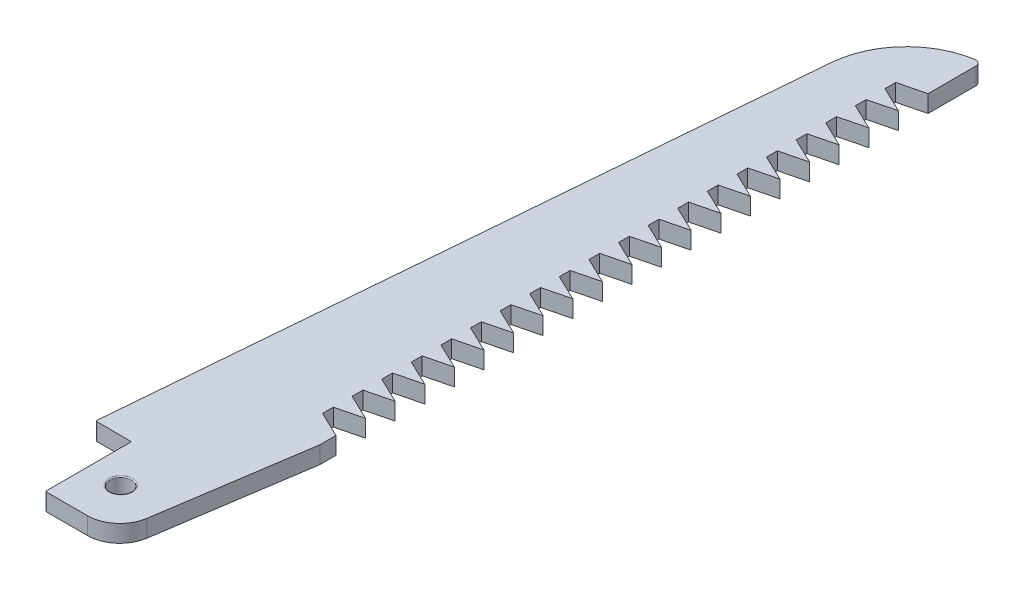
from build123d import *

# Parameters (mm, degrees)
SKETCH1_R           = 1
BOSS_EXTRUDE2_DEPTH = 1.6
SKETCH3_W           = 3.5
SKETCH3_H           = 8
CUT_EXTRUDE2_DEPTH  = 80.011454866
FILLET2_R           = 3
FILLET3_R           = 0.1
FILLET4_R           = 0.1
CUT_EXTRUDE3_DEPTH  = 80.011454866
LPATTERN7_COUNT     = 20
LPATTERN7_PITCH     = 2.75
FILLET5_R           = 0.5


with BuildPart() as part:
    # Sketch1 → Boss-Extrude2 (new body)
    with BuildSketch(Plane(origin=(0, 0, 0), x_dir=(1, 0, 0), z_dir=(0, 1, 0))):
        with BuildLine():
            Line((0, 0), (0, 6))
            Line((0, 6), (5.5, 71))
            ThreePointArc((5.5, 71), (7.72044875, 75.77955125), (12.5, 78))
            Line((12.5, 78), (12.5, 16.5))
            Line((12.5, 16.5), (10, 0))
            Line((10, 0), (0, 0))
        make_face()
        with Locations(Location((6.5, 4, 0), (0, 0, 270))):
            Circle(SKETCH1_R, mode=Mode.SUBTRACT)
    extrude(amount=BOSS_EXTRUDE2_DEPTH)

    # Sketch3 → Cut-Extrude2 (cut, through all)
    with BuildSketch(Plane(origin=(0, 1.6, 0), x_dir=(1, 0, 0), z_dir=(0, 1, 0))):
        with Locations((1.75, 4)):
            Rectangle(SKETCH3_W, SKETCH3_H)
    extrude(amount=-CUT_EXTRUDE2_DEPTH, mode=Mode.SUBTRACT)

    # Fillet2
    fillet2_edges = [part.edges().sort_by_distance(p)[0] for p in [
        (10, 0.8, 0),
    ]]
    fillet(fillet2_edges, radius=FILLET2_R)

    # Fillet3
    fillet3_edges = [part.edges().sort_by_distance(p)[0] for p in [
        (6.5, 0, -5),
        (6.5, 1.6, -5),
    ]]
    fillet(fillet3_edges, radius=FILLET3_R)

    # Fillet4
    fillet4_edges = [part.edges().sort_by_distance(p)[0] for p in [
        (0.169230769, 0.8, -8),
        (3.5, 0.8, -8),
        (3.5, 0.8, 0),
    ]]
    fillet(fillet4_edges, radius=FILLET4_R)

    # Sketch4 → Cut-Extrude3 (cut, through all)
    with BuildSketch(Plane(origin=(0, 1.6, 0), x_dir=(1, 0, 0), z_dir=(0, 1, 0))):
        Polygon((12.5, 73), (10.1, 72.398256348), (10.1, 71.398256348), (12.5, 70.25), align=None)
    cut_extrude3 = extrude(amount=-CUT_EXTRUDE3_DEPTH, mode=Mode.SUBTRACT)

    # LPattern7: Cut-Extrude3 ×20
    with Locations(*[(0, 0, i * LPATTERN7_PITCH) for i in range(1, LPATTERN7_COUNT)]):
        add(cut_extrude3, mode=Mode.SUBTRACT)

    # Fillet5
    fillet5_edges = [part.edges().sort_by_distance(p)[0] for p in [
        (12.5, 0.8, -78),
    ]]
    fillet(fillet5_edges, radius=FILLET5_R)


solid = part.part
